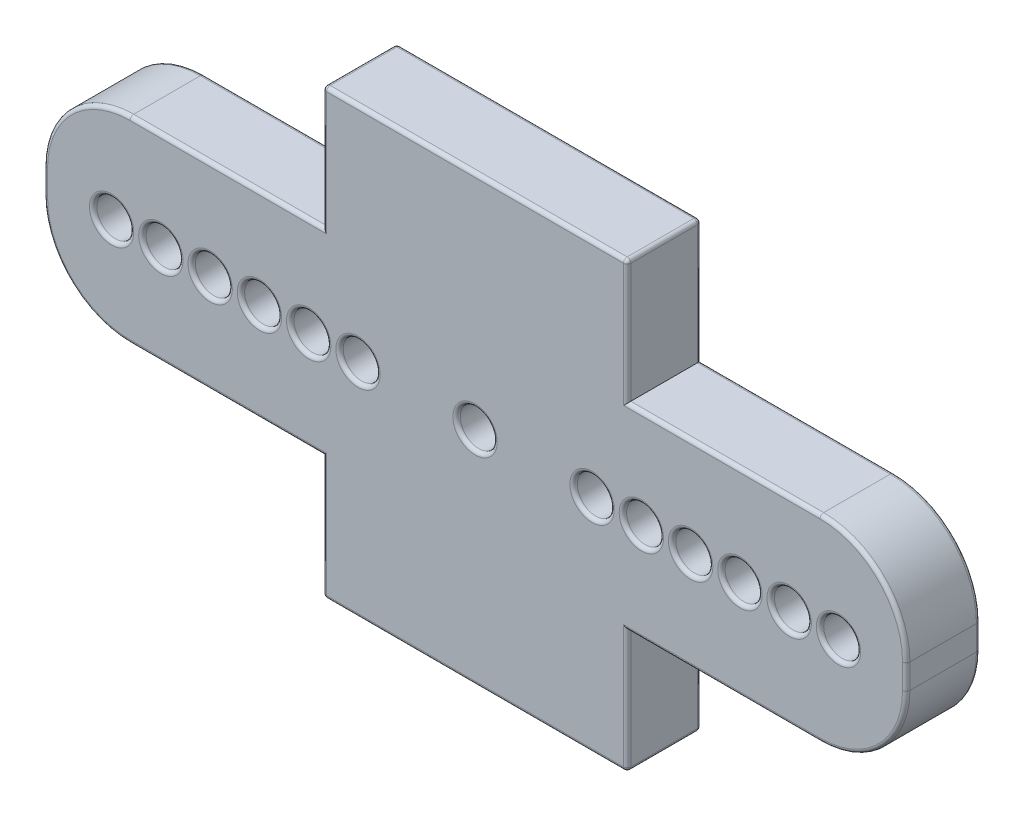
from build123d import *

# Parameters (mm, degrees)
SKETCH1_R           = 0.75
BOSS_EXTRUDE1_DEPTH = 1.5
SKETCH2_R           = 0.75
CUT_EXTRUDE1_DEPTH  = 20.906029237
FILLET1_R           = 0.15


with BuildPart() as part:
    # Sketch1 → Boss-Extrude1 (new, symmetric)
    with BuildSketch(Plane.XY):
        with BuildLine():
            Line((-17.5, 0.5), (-17.5, -0.5))
            ThreePointArc((-17.5, -0.5), (-16.474873734, -2.974873734), (-14, -4))
            Line((-14, -4), (-6.175, -4))
            Line((-6.175, -4), (-6.175, -9))
            Line((-6.175, -9), (6.175, -9))
            Line((6.175, -9), (6.175, -4))
            Line((6.175, -4), (14, -4))
            ThreePointArc((14, -4), (16.474873734, -2.974873734), (17.5, -0.5))
            Line((17.5, -0.5), (17.5, 0.5))
            ThreePointArc((17.5, 0.5), (16.474873734, 2.974873734), (14, 4))
            Line((14, 4), (6.175, 4))
            Line((6.175, 4), (6.175, 9))
            Line((6.175, 9), (-6.175, 9))
            Line((-6.175, 9), (-6.175, 4))
            Line((-6.175, 4), (-14, 4))
            ThreePointArc((-14, 4), (-16.474873734, 2.974873734), (-17.5, 0.5))
        make_face()
        Circle(SKETCH1_R, mode=Mode.SUBTRACT)
    extrude(amount=BOSS_EXTRUDE1_DEPTH, both=True)

    # Sketch2 → Cut-Extrude1 (cut, through all)
    with BuildSketch(Plane.XY.offset(1.5)):
        with Locations((-14.75, 0)):
            Circle(SKETCH2_R)
        with Locations((-12.75, 0)):
            Circle(SKETCH2_R)
        with Locations((-10.75, 0)):
            Circle(SKETCH2_R)
        with Locations((-8.75, 0)):
            Circle(SKETCH2_R)
        with Locations((-6.75, 0)):
            Circle(SKETCH2_R)
        with Locations((-4.75, 0)):
            Circle(SKETCH2_R)
    cut_extrude1 = extrude(amount=-CUT_EXTRUDE1_DEPTH, mode=Mode.SUBTRACT)

    # Mirror1: Cut-Extrude1 across plane
    add(cut_extrude1.mirror(Plane(origin=(0, 0, 0), x_dir=(0, 0, 1), z_dir=(1, 0, 0))), mode=Mode.SUBTRACT)

    # Fillet1
    fillet1_edges = [part.edges().sort_by_distance(p)[0] for p in [
        (-10.0875, 4, 1.5),
        (6.175, 6.5, -1.5),
        (10.0875, 4, -1.5),
        (16.474873734, 2.974873734, -1.5),
        (-16.474873734, 2.974873734, 1.5),
        (17.5, 0, -1.5),
        (16.474873734, -2.974873734, -1.5),
        (10.0875, -4, -1.5),
        (6.175, -6.5, -1.5),
        (0, -9, -1.5),
        (-6.175, -6.5, -1.5),
        (-10.0875, -4, -1.5),
        (-16.474873734, -2.974873734, -1.5),
        (-17.5, 0, -1.5),
        (-16.474873734, 2.974873734, -1.5),
        (-17.5, 0, 1.5),
        (-10.0875, 4, -1.5),
        (-6.175, 6.5, -1.5),
        (0, 9, -1.5),
        (-16.474873734, -2.974873734, 1.5),
        (6.175, 9, 0),
        (6.175, -9, 0),
        (-6.175, -9, 0),
        (-6.175, 9, 0),
        (-10.0875, -4, 1.5),
        (-6.175, -6.5, 1.5),
        (0, -9, 1.5),
        (-0.75, 0, -1.5),
        (-0.75, 0, 1.5),
        (6.175, -6.5, 1.5),
        (10.0875, -4, 1.5),
        (16.474873734, -2.974873734, 1.5),
        (0, 9, 1.5),
        (17.5, 0, 1.5),
        (16.474873734, 2.974873734, 1.5),
        (10.0875, 4, 1.5),
        (-15.5, 0, -1.5),
        (-15.5, 0, 1.5),
        (-13.5, 0, -1.5),
        (-13.5, 0, 1.5),
        (-11.5, 0, -1.5),
        (6.175, 6.5, 1.5),
        (-11.5, 0, 1.5),
        (-9.5, 0, -1.5),
        (-9.5, 0, 1.5),
        (-7.5, 0, -1.5),
        (-7.5, 0, 1.5),
        (-5.5, 0, -1.5),
        (-5.5, 0, 1.5),
        (15.5, 0, 1.5),
        (15.5, 0, -1.5),
        (-6.175, 6.5, 1.5),
        (13.5, 0, 1.5),
        (13.5, 0, -1.5),
        (11.5, 0, 1.5),
        (11.5, 0, -1.5),
        (9.5, 0, 1.5),
        (9.5, 0, -1.5),
        (7.5, 0, 1.5),
        (7.5, 0, -1.5),
        (5.5, 0, 1.5),
        (5.5, 0, -1.5),
    ]]
    fillet(fillet1_edges, radius=FILLET1_R)


solid = part.part
